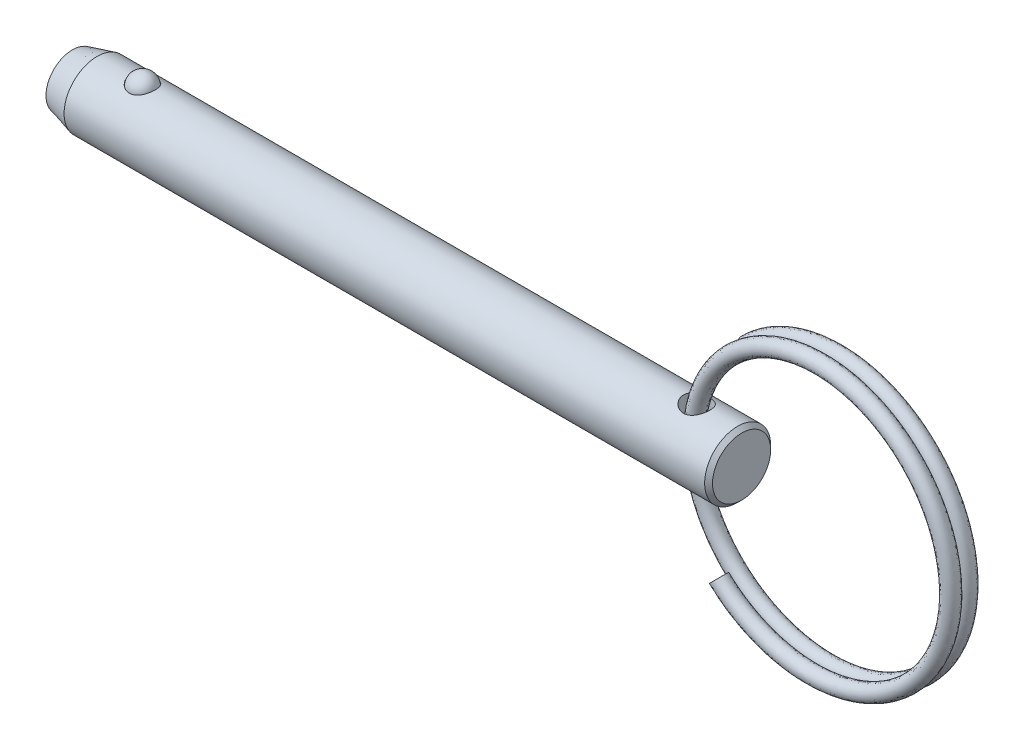
from build123d import *

# Parameters (mm, degrees)
SKETCH4_W          = 1.27
SKETCH4_H          = 6.35
SWEEP1_PITCH       = 1.5494
SWEEP1_HEIGHT      = 1.355725
SWEEP1_RADIUS      = 13.462
SKETCH6_R          = 0.762
SWEEP2_PITCH       = 1.5494
SWEEP2_HEIGHT      = 1.355725
SWEEP2_RADIUS      = 13.462
SWEEP2_START_ANGLE = -180
SKETCH6_2_R        = 0.762


with BuildPart() as part:
    # Sketch1 → Revolve1 (revolve)
    with BuildSketch(Plane.XY, mode=Mode.PRIVATE) as revolve1_sk:
        Polygon((32.1564, 2.794), (31.7754, 3.175), (-29.786547737, 3.175), (-32.1564, 2.54), (-32.1564, 0), (32.1564, 0), align=None)
    revolve(revolve1_sk.sketch.rotate(Axis((32.1564, 0, 0), (1, 0, 0)), 90), axis=Axis((32.1564, 0, 0), (1, 0, 0)))

    # Sketch2 → Cut-Revolve1 (revolve, cut)
    with BuildSketch(Plane.XY):
        with BuildLine():
            Line((-24.164582051, 2.8575), (-26.679182051, 2.8575))
            ThreePointArc((-26.679182051, 2.8575), (-25.421882051, 4.1148), (-24.164582051, 2.8575))
        make_face()
    revolve(axis=Axis((-24.164582051, 2.8575, 0), (1, 0, 0)), mode=Mode.SUBTRACT)

    # Sketch4 → Cut-Revolve2 (revolve, cut)
    with BuildSketch(Plane.XY, mode=Mode.PRIVATE) as cut_revolve2_sk:
        with Locations((28.4734, 0)):
            Rectangle(SKETCH4_W, SKETCH4_H)
    revolve(cut_revolve2_sk.sketch.rotate(Axis((27.8384, -3.175, 0), (0, 1, 0)), 90), axis=Axis((27.8384, -3.175, 0), (0, 1, 0)), mode=Mode.SUBTRACT)


with BuildPart() as body_2:
    # Sketch3 → Revolve2 (revolve)
    with BuildSketch(Plane.XY):
        with BuildLine():
            Line((-24.189982051, 2.8575), (-26.653782051, 2.8575))
            ThreePointArc((-26.653782051, 2.8575), (-25.421882051, 4.0894), (-24.189982051, 2.8575))
        make_face()
    revolve(axis=Axis((-24.189982051, 2.8575, 0), (1, 0, 0)))


with BuildPart() as body_3:
    # Sweep1: sweep along a helix
    with BuildLine() as sweep1_path:
        Helix(SWEEP1_PITCH, SWEEP1_HEIGHT, SWEEP1_RADIUS, center=(40.323425091, 0, 0), direction=(0, 0, -1), lefthand=True)
    # Sketch6 → Sweep1 (sweep)
    with BuildSketch(Plane(origin=(114.003847968, 0, 0), x_dir=(0, 0, -1), z_dir=(0, 1, 0))):
        with Locations((0, 86.380422877)):
            Circle(SKETCH6_R)
    sweep(path=sweep1_path.line, is_frenet=True)

    # Sweep2: sweep along a helix
    with BuildLine() as sweep2_path:
        add(Helix(SWEEP2_PITCH, SWEEP2_HEIGHT, SWEEP2_RADIUS, center=(40.323425091, 0, 0), direction=(0, 0, 1), lefthand=True, mode=Mode.PRIVATE).rotate(Axis((40.323425091, 0, 0), (0, 0, 1)), SWEEP2_START_ANGLE))
    # Sketch6<2> → Sweep2 (sweep)
    with BuildSketch(Plane(origin=(114.003847968, 0, 0), x_dir=(0, 0, -1), z_dir=(0, 1, 0))):
        with Locations((0, 86.380422877)):
            Circle(SKETCH6_2_R)
    sweep(path=sweep2_path.line, is_frenet=True)


solid = Compound([part.part, body_2.part, body_3.part])
